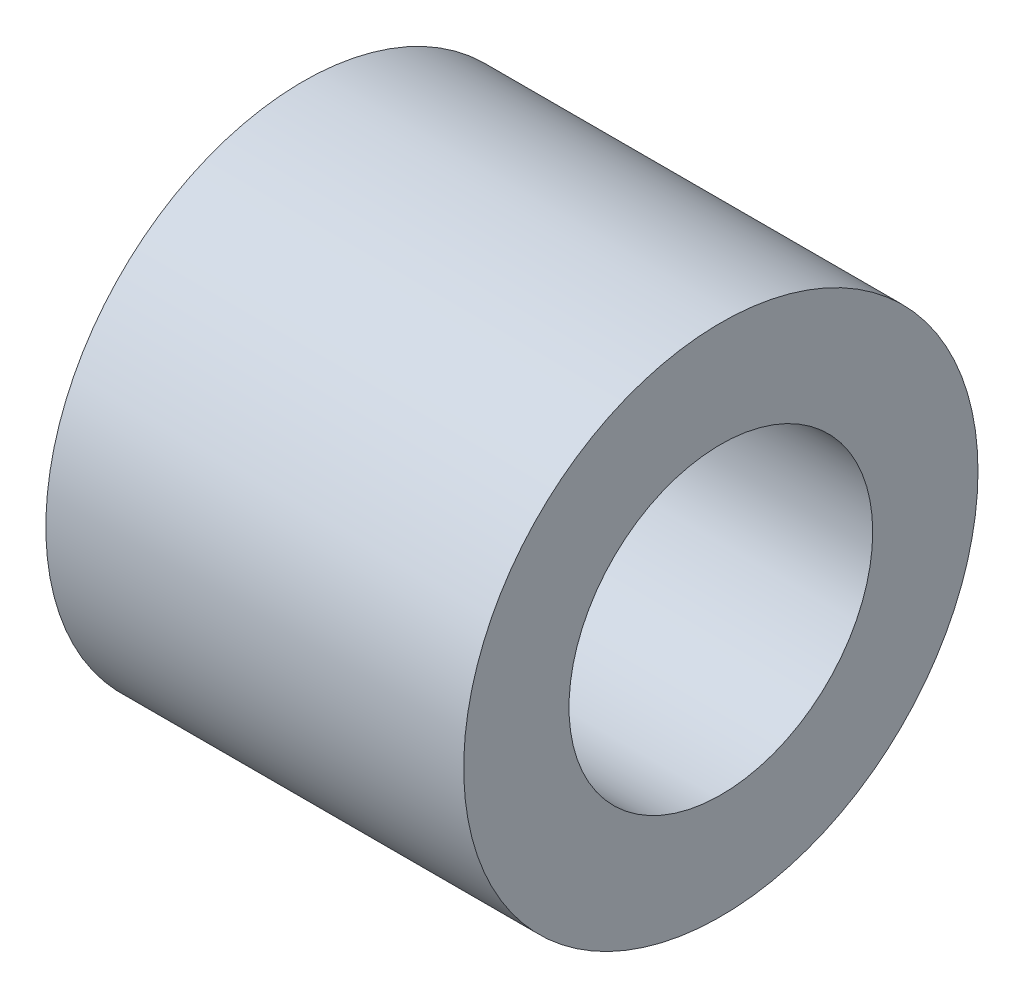
from build123d import *

# Parameters (mm, degrees)
SKETCH1_R           = 5.08
SKETCH1_R_2         = 3.175
BOSS_EXTRUDE1_DEPTH = 3.175
BOSS_EXTRUDE2_START = 5.08
SKETCH1_3_R         = 5.08
SKETCH1_3_R_2       = 3
BOSS_EXTRUDE2_DEPTH = 5.08


with BuildPart() as part:
    # Sketch1 → Boss-Extrude1 (new body)
    with BuildSketch(Plane(origin=(0, 0, 0), x_dir=(0, 0, -1), z_dir=(1, 0, 0))):
        Circle(SKETCH1_R)
        Circle(SKETCH1_R_2, mode=Mode.SUBTRACT)
    extrude(amount=-BOSS_EXTRUDE1_DEPTH)

    # Sketch1<3> → Boss-Extrude2 (add)
    with BuildSketch(Plane(origin=(0, 0, 0), x_dir=(0, 0, -1), z_dir=(1, 0, 0)).offset(BOSS_EXTRUDE2_START)):
        Circle(SKETCH1_3_R)
        Circle(SKETCH1_3_R_2, mode=Mode.SUBTRACT)
    extrude(amount=-BOSS_EXTRUDE2_DEPTH)


solid = part.part
